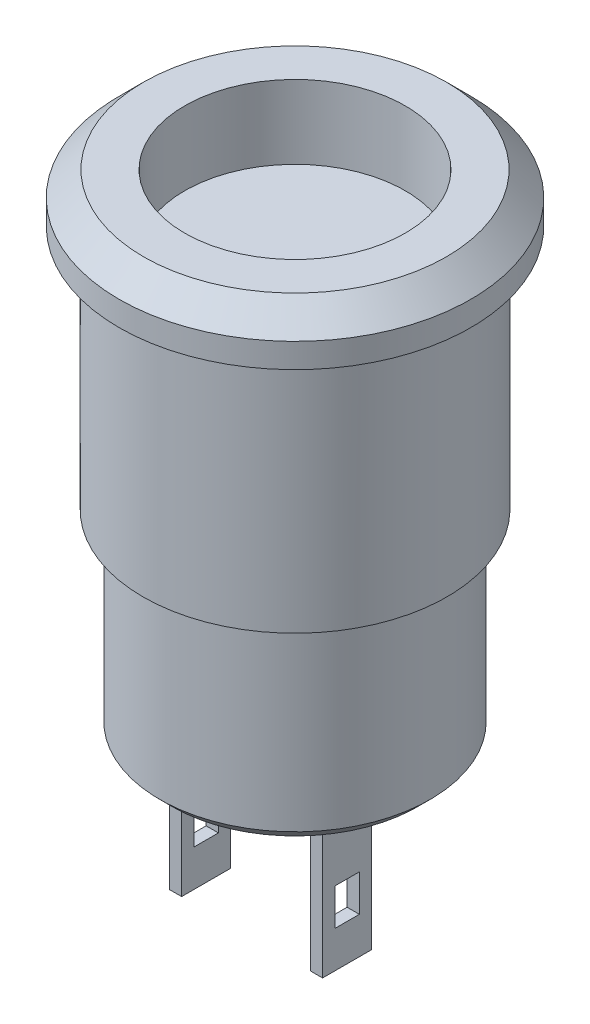
from build123d import *

# Parameters (mm, degrees)
SKETCH1_R           = 7.175
BOSS_EXTRUDE1_DEPTH = 2
SKETCH2_R           = 6.2
BOSS_EXTRUDE2_DEPTH = 10
SKETCH3_R           = 5.515
BOSS_EXTRUDE3_DEPTH = 8
CHAMFER2_SIZE       = 1
CHAMFER3_SIZE       = 0.5
SKETCH4_W           = 0.5
SKETCH4_H           = 2
BOSS_EXTRUDE4_DEPTH = 6
SKETCH5_W           = 1
SKETCH5_H           = 1.5
CUT_EXTRUDE1_DEPTH  = 28.084508949
BOSS_EXTRUDE6_DEPTH = 0.1
SKETCH6_R           = 4.5
CUT_EXTRUDE2_DEPTH  = 3


with BuildPart() as part:
    # Sketch1 → Boss-Extrude1 (new body)
    with BuildSketch(Plane(origin=(0, 0, 0), x_dir=(1, 0, 0), z_dir=(0, 1, 0))):
        with Locations(Location((0, 0, 0), (0, 0, 270))):
            Circle(SKETCH1_R)
    extrude(amount=BOSS_EXTRUDE1_DEPTH)

    # Sketch2 → Boss-Extrude2 (add)
    with BuildSketch(Plane.XZ):
        with Locations(Location((0, 0, 0), (0, 0, 90))):
            Circle(SKETCH2_R)
    extrude(amount=BOSS_EXTRUDE2_DEPTH)

    # Sketch3 → Boss-Extrude3 (add)
    with BuildSketch(Plane.XZ.offset(10)):
        with Locations(Location((0, 0, 0), (0, 0, 270))):
            Circle(SKETCH3_R)
    extrude(amount=BOSS_EXTRUDE3_DEPTH)

    # Chamfer2
    chamfer2_edges = [part.edges().sort_by_distance(p)[0] for p in [
        (0, 2, -7.175),
    ]]
    chamfer(chamfer2_edges, length=CHAMFER2_SIZE)

    # Chamfer3
    chamfer3_edges = [part.edges().sort_by_distance(p)[0] for p in [
        (0, -18, 5.515),
    ]]
    chamfer(chamfer3_edges, length=CHAMFER3_SIZE)

    # Sketch4 → Boss-Extrude4 (add)
    with BuildSketch(Plane.XZ.offset(18)):
        with Locations((2.875, 1)):
            Rectangle(SKETCH4_W, SKETCH4_H)
        with Locations((-2.875, 1)):
            Rectangle(SKETCH4_W, SKETCH4_H)
    extrude(amount=BOSS_EXTRUDE4_DEPTH)

    # Sketch5 → Cut-Extrude1 (cut, through all)
    with BuildSketch(Plane.ZY.offset(3.125)):
        with Locations((1, -21.75)):
            Rectangle(SKETCH5_W, SKETCH5_H)
    extrude(amount=-CUT_EXTRUDE1_DEPTH, mode=Mode.SUBTRACT)

    # Sketch7 → Boss-Extrude6 (add)
    # profile 1 of 18: a face of its own
    with BuildSketch(Plane(origin=(0, -18, 0), x_dir=(-1, 0, 0), z_dir=(0, -1, 0))):
        with BuildLine():
            Line((-2.393810309, 3.233762313), (-2.456630821, 3.233762313))
            add(Edge.make_bspline(
                [(-2.456630821, 3.233762313), (-2.454928911, 3.24080881), (-2.451601816, 3.254584135), (-2.444662301, 3.274265587), (-2.43710245, 3.292890291), (-2.428024629, 3.310109506), (-2.418122879, 3.326269286), (-2.406778334, 3.341003111), (-2.39451439, 3.354685704), (-2.3809494, 3.366828352), (-2.366723668, 3.377823898), (-2.351636744, 3.387198909), (-2.335992165, 3.39526374), (-2.319681538, 3.401907786), (-2.302656304, 3.406912891), (-2.285070379, 3.410544252), (-2.266877679, 3.412902475), (-2.254528161, 3.413132628), (-2.248257424, 3.413249493)],
                knots=[0, 0, 0, 0, 1.162005537, 2.271625781, 3.343758855, 4.383309926, 5.390229558, 6.379919256, 7.361854164, 8.333198761, 9.295911338, 10.242430842, 11.177959212, 12.116337295, 13.062827104, 14.020064771, 14.994644689, 16, 16, 16, 16], degree=3))
            add(Edge.make_bspline(
                [(-2.248257424, 3.413249493), (-2.239120875, 3.412973647), (-2.221047073, 3.412427971), (-2.194494464, 3.407445084), (-2.1688891, 3.399560058), (-2.144511251, 3.388665312), (-2.121867564, 3.37522785), (-2.101720327, 3.359234902), (-2.084342624, 3.340995042), (-2.069763749, 3.320848529), (-2.058348749, 3.299317427), (-2.049931474, 3.277157396), (-2.044807138, 3.254421001), (-2.044143027, 3.239069546), (-2.043810309, 3.231378499)],
                knots=[0, 0, 0, 0, 1.083050992, 2.142477498, 3.193116406, 4.255571735, 5.30263384, 6.308962982, 7.297363603, 8.282367274, 9.249857812, 10.179914175, 11.08814088, 12, 12, 12, 12], degree=3))
            add(Edge.make_bspline(
                [(-2.043810309, 3.231378499), (-2.044043027, 3.22397714), (-2.04449842, 3.209493829), (-2.048365161, 3.18834953), (-2.054872414, 3.16842121), (-2.063886366, 3.149624977), (-2.075554676, 3.132080009), (-2.089689216, 3.115746831), (-2.106389748, 3.100552999), (-2.119045536, 3.091849105), (-2.12556111, 3.087368082)],
                knots=[0, 0, 0, 0, 1.024540389, 2.004866551, 2.965041327, 3.920577974, 4.882998113, 5.874504559, 6.905732034, 8, 8, 8, 8], degree=3))
            add(Edge.make_bspline(
                [(-2.12556111, 3.087368082), (-2.118114759, 3.083772448), (-2.103361384, 3.076648456), (-2.083251278, 3.062677305), (-2.064995703, 3.046546036), (-2.054814959, 3.033957505), (-2.049699732, 3.027632505)],
                knots=[0, 0, 0, 0, 1.015518401, 2.012035669, 3.001164323, 4, 4, 4, 4], degree=3))
            add(Edge.make_bspline(
                [(-2.049699732, 3.027632505), (-2.046331463, 3.023020955), (-2.039650084, 3.013873372), (-2.031402977, 2.999166087), (-2.023921154, 2.984295789), (-2.01809111, 2.968863908), (-2.013576337, 2.953049305), (-2.010349131, 2.936824826), (-2.008344302, 2.920177221), (-2.008057192, 2.908914725), (-2.007912873, 2.903253499)],
                knots=[0, 0, 0, 0, 1.025084078, 2.033381695, 3.024893161, 4.013698104, 4.991890475, 5.976764909, 6.982997093, 8, 8, 8, 8], degree=3))
            add(Edge.make_bspline(
                [(-2.007912873, 2.903253499), (-2.008271775, 2.893451555), (-2.008987892, 2.873893794), (-2.015388707, 2.84499885), (-2.025311355, 2.81675375), (-2.039402742, 2.789738782), (-2.056576244, 2.764462706), (-2.077007709, 2.741847444), (-2.10046499, 2.722407723), (-2.12662612, 2.706165677), (-2.154969546, 2.693182093), (-2.185284664, 2.684170604), (-2.217134675, 2.678301404), (-2.238976134, 2.677672031), (-2.250080341, 2.677352057)],
                knots=[0, 0, 0, 0, 0.955779014, 1.907060117, 2.875433937, 3.871313158, 4.872415639, 5.851225146, 6.836215519, 7.83643374, 8.849228613, 9.86973379, 10.916971861, 12, 12, 12, 12], degree=3))
            add(Edge.make_bspline(
                [(-2.250080341, 2.677352057), (-2.257564201, 2.677525699), (-2.272289942, 2.67786737), (-2.293938641, 2.68020309), (-2.314602981, 2.684469091), (-2.334310901, 2.690209753), (-2.353079908, 2.697488101), (-2.370852729, 2.706551841), (-2.387738708, 2.717214141), (-2.403578498, 2.729600859), (-2.418370212, 2.743457126), (-2.431720756, 2.759028928), (-2.443852715, 2.776028409), (-2.454441243, 2.79465302), (-2.463968633, 2.814662072), (-2.471804825, 2.836311772), (-2.478701938, 2.859408576), (-2.481908631, 2.875504124), (-2.483553898, 2.883762313)],
                knots=[0, 0, 0, 0, 1.048658725, 2.063410685, 3.046034179, 4.001477787, 4.936774919, 5.862367409, 6.792675028, 7.730719943, 8.675894397, 9.627829632, 10.600096036, 11.597688215, 12.626045268, 13.701542398, 14.82072376, 16, 16, 16, 16], degree=3))
            Line((-2.483553898, 2.883762313), (-2.420733385, 2.883762313))
            add(Edge.make_bspline(
                [(-2.420733385, 2.883762313), (-2.419096727, 2.87837251), (-2.415913285, 2.867888876), (-2.410494425, 2.852800815), (-2.404320771, 2.838969204), (-2.397697859, 2.82629258), (-2.39074217, 2.814646099), (-2.382959185, 2.804337726), (-2.374925356, 2.794914685), (-2.368869485, 2.789605763), (-2.365905661, 2.787007505)],
                knots=[0, 0, 0, 0, 1.198163088, 2.33053128, 3.407730985, 4.417276592, 5.372219308, 6.28897303, 7.162600585, 8, 8, 8, 8], degree=3))
            add(Edge.make_bspline(
                [(-2.365905661, 2.787007505), (-2.361986346, 2.783985839), (-2.354159813, 2.777951832), (-2.341406167, 2.770251507), (-2.32799319, 2.763579301), (-2.313630255, 2.758482562), (-2.298627301, 2.75416703), (-2.282741828, 2.751342926), (-2.266113984, 2.749405292), (-2.254760432, 2.749234306), (-2.248958546, 2.749146928)],
                knots=[0, 0, 0, 0, 0.946170439, 1.889420265, 2.845303464, 3.807233317, 4.801018734, 5.828864929, 6.890507805, 8, 8, 8, 8], degree=3))
            add(Edge.make_bspline(
                [(-2.248958546, 2.749146928), (-2.242407845, 2.74927011), (-2.229598516, 2.749510979), (-2.210907544, 2.751726121), (-2.193126054, 2.754952203), (-2.176451469, 2.7599348), (-2.160665368, 2.76609097), (-2.145989038, 2.773820651), (-2.132229817, 2.782889596), (-2.119563936, 2.793197427), (-2.108174834, 2.804481727), (-2.098146931, 2.816284341), (-2.089621999, 2.828555507), (-2.082745283, 2.841363131), (-2.077315173, 2.854654177), (-2.073618533, 2.868465942), (-2.07104823, 2.882685396), (-2.070838908, 2.892351189), (-2.070733385, 2.897223852)],
                knots=[0, 0, 0, 0, 1.217147791, 2.380027433, 3.494444702, 4.572153297, 5.609568379, 6.639424714, 7.649109417, 8.668170816, 9.669597737, 10.625200337, 11.543417969, 12.441394052, 13.322311151, 14.205496177, 15.095365482, 16, 16, 16, 16], degree=3))
            add(Edge.make_bspline(
                [(-2.070733385, 2.897223852), (-2.071039446, 2.903746119), (-2.071650043, 2.916758201), (-2.076311759, 2.935901716), (-2.083979532, 2.954346398), (-2.094714034, 2.971777556), (-2.10778118, 2.987932737), (-2.123054162, 3.002347033), (-2.140659807, 3.014241051), (-2.156863781, 3.022458783), (-2.171216812, 3.028066198), (-2.183499889, 3.031801191), (-2.19725121, 3.034963922), (-2.21230448, 3.037906376), (-2.228773123, 3.040410646), (-2.246639211, 3.042499009), (-2.265906363, 3.044170017), (-2.279244596, 3.044916236), (-2.286118001, 3.045300775)],
                knots=[0, 0, 0, 0, 1.07054697, 2.135767047, 3.216561865, 4.33974944, 5.486079747, 6.621378074, 7.775625952, 8.963672916, 9.598146892, 10.304877434, 11.070270905, 11.915000392, 12.823868403, 13.805723172, 14.86925407, 16, 16, 16, 16], degree=3))
            Line((-2.286118001, 3.045300775), (-2.286118001, 3.117095646))
            add(Edge.make_bspline(
                [(-2.286118001, 3.117095646), (-2.277457768, 3.117242607), (-2.260494498, 3.117530467), (-2.235715637, 3.121012069), (-2.212020975, 3.125828195), (-2.189935627, 3.133205233), (-2.169805884, 3.141773293), (-2.152341963, 3.151743735), (-2.137788534, 3.162826684), (-2.12621632, 3.175193206), (-2.117510474, 3.188456216), (-2.111145115, 3.202279547), (-2.107385049, 3.21678436), (-2.106883116, 3.226683293), (-2.106630821, 3.231658948)],
                knots=[0, 0, 0, 0, 1.321986639, 2.589447074, 3.816329219, 5.01088745, 6.139805852, 7.153945165, 8.075214402, 8.924034688, 9.728124013, 10.488707548, 11.240355623, 12, 12, 12, 12], degree=3))
            add(Edge.make_bspline(
                [(-2.106630821, 3.231658948), (-2.106713704, 3.235314497), (-2.106878594, 3.242587038), (-2.108958049, 3.253212052), (-2.112082857, 3.263512241), (-2.116378803, 3.273443803), (-2.122128843, 3.282937858), (-2.12901004, 3.292075348), (-2.13720366, 3.300804103), (-2.14659275, 3.308940167), (-2.156675111, 3.316694015), (-2.167725066, 3.323276742), (-2.179409441, 3.328905755), (-2.191741172, 3.333547655), (-2.204760278, 3.337039513), (-2.218405589, 3.339546681), (-2.232703126, 3.341114212), (-2.242457472, 3.341339895), (-2.247416078, 3.341454621)],
                knots=[0, 0, 0, 0, 0.884392785, 1.759457502, 2.611959086, 3.489218968, 4.37281399, 5.2945488, 6.255912374, 7.266815255, 8.301784654, 9.332968512, 10.37626691, 11.440494194, 12.520033166, 13.637162961, 14.798855837, 16, 16, 16, 16], degree=3))
            add(Edge.make_bspline(
                [(-2.247416078, 3.341454621), (-2.255386411, 3.341176348), (-2.270954327, 3.340632818), (-2.29339731, 3.335872215), (-2.314261177, 3.328276598), (-2.33020891, 3.319209994), (-2.341985425, 3.310259908), (-2.350400813, 3.30244343), (-2.358664915, 3.293756866), (-2.36623405, 3.283665191), (-2.373888845, 3.272851833), (-2.380857758, 3.260767096), (-2.387629696, 3.247726217), (-2.391710206, 3.23850709), (-2.393810309, 3.233762313)],
                knots=[0, 0, 0, 0, 1.472543308, 2.876219568, 4.221790263, 5.565193594, 6.249813518, 6.953379497, 7.687249741, 8.463570142, 9.283606569, 10.136032583, 11.040678096, 12, 12, 12, 12], degree=3))
        make_face()
    # profile 2 of 18: a face of its own
    with BuildSketch(Plane(origin=(0, -18, 0), x_dir=(-1, 0, 0), z_dir=(0, -1, 0))):
        Polygon((-1.59509236, 3.395300775), (-1.272015437, 2.695300775), (-1.3403047, 2.695300775), (-1.443790276, 2.919659749), (-1.761118001, 2.919659749), (-1.867548289, 2.695300775), (-1.936118001, 2.695300775), (-1.604066719, 3.395300775), align=None)
        Polygon((-1.600280661, 3.258862473), (-1.727043482, 2.991454621), (-1.476883225, 2.991454621), align=None, mode=Mode.SUBTRACT)
    # profile 3 of 18: a face of its own
    with BuildSketch(Plane(origin=(0, -18, 0), x_dir=(-1, 0, 0), z_dir=(0, -1, 0))):
        Polygon((-1.060416879, 3.395300775), (-0.930989796, 3.395300775), (-0.930989796, 2.695300775), (-0.993810309, 2.695300775), (-0.993810309, 3.323505903), (-1.101502616, 3.323505903), align=None)
    # profile 4 of 18: a face of its own
    with BuildSketch(Plane(origin=(0, -18, 0), x_dir=(-1, 0, 0), z_dir=(0, -1, 0))):
        with BuildLine():
            Line((-0.580989796, 3.179916159), (-0.643810309, 3.179916159))
            add(Edge.make_bspline(
                [(-0.643810309, 3.179916159), (-0.643400878, 3.188250337), (-0.642596767, 3.20461844), (-0.638831109, 3.228483221), (-0.633442934, 3.251294181), (-0.625824643, 3.272868164), (-0.616363387, 3.293395925), (-0.605017382, 3.312795928), (-0.591578612, 3.330994166), (-0.576337265, 3.347821935), (-0.559783537, 3.363259449), (-0.541922349, 3.376590497), (-0.523153344, 3.387854032), (-0.503533464, 3.39727028), (-0.482841351, 3.404338249), (-0.46126478, 3.409582577), (-0.438708953, 3.412737846), (-0.423340948, 3.413077003), (-0.415525052, 3.413249493)],
                knots=[0, 0, 0, 0, 1.10065271, 2.161652631, 3.183658789, 4.190468796, 5.17591951, 6.163126047, 7.15150782, 8.156236427, 9.156009102, 10.134482811, 11.092018607, 12.041330605, 13.001268258, 13.972401359, 14.968799086, 16, 16, 16, 16], degree=3))
            add(Edge.make_bspline(
                [(-0.415525052, 3.413249493), (-0.407849437, 3.413069801), (-0.392767128, 3.412716714), (-0.370754725, 3.409684508), (-0.349799267, 3.40493539), (-0.329941713, 3.398272307), (-0.3113405, 3.389315421), (-0.293855891, 3.378555914), (-0.277279729, 3.366111947), (-0.262358373, 3.351461185), (-0.248656757, 3.335820708), (-0.236836306, 3.319123127), (-0.226713673, 3.30187727), (-0.218276137, 3.28395163), (-0.212064909, 3.265177424), (-0.207349268, 3.245827983), (-0.204683785, 3.225703021), (-0.2042747, 3.21208171), (-0.204066719, 3.205156544)],
                knots=[0, 0, 0, 0, 1.111607364, 2.184268762, 3.212621178, 4.221274766, 5.211760367, 6.196651075, 7.1921475, 8.207485113, 9.220403448, 10.201281604, 11.166441695, 12.114753415, 13.065576456, 14.026450734, 14.996634279, 16, 16, 16, 16], degree=3))
            add(Edge.make_bspline(
                [(-0.204066719, 3.205156544), (-0.204405371, 3.195406977), (-0.205076734, 3.176078934), (-0.210819609, 3.147675962), (-0.219788911, 3.120157278), (-0.230588383, 3.098009817), (-0.241482871, 3.080163119), (-0.251300373, 3.065469378), (-0.262793335, 3.049648284), (-0.276129035, 3.032752817), (-0.291031609, 3.014650636), (-0.307636042, 2.995352676), (-0.326060738, 2.975058322), (-0.338992438, 2.961197202), (-0.345693321, 2.954014717)],
                knots=[0, 0, 0, 0, 1.184426356, 2.348067706, 3.509069118, 4.696110526, 5.333549288, 6.050745305, 6.844228056, 7.710549037, 8.667450064, 9.695053472, 10.805634456, 12, 12, 12, 12], degree=3))
            Line((-0.345693321, 2.954014717), (-0.520833546, 2.767095646))
            Line((-0.520833546, 2.767095646), (-0.19509236, 2.767095646))
            Line((-0.19509236, 2.767095646), (-0.19509236, 2.695300775))
            Line((-0.19509236, 2.695300775), (-0.670733385, 2.695300775))
            Line((-0.670733385, 2.695300775), (-0.399259026, 2.9850043))
            add(Edge.make_bspline(
                [(-0.399259026, 2.9850043), (-0.392649449, 2.991903962), (-0.379953804, 3.005156799), (-0.361997288, 3.024505391), (-0.345869491, 3.042455299), (-0.331466012, 3.058972609), (-0.319099311, 3.074298922), (-0.308124865, 3.087937863), (-0.299331746, 3.100488753), (-0.289788667, 3.115036876), (-0.280545871, 3.132799339), (-0.2726034, 3.154506077), (-0.26776043, 3.176851528), (-0.267179463, 3.191951935), (-0.266887232, 3.199547569)],
                knots=[0, 0, 0, 0, 1.329631726, 2.553950428, 3.673215718, 4.687767853, 5.603093632, 6.413772471, 7.123043292, 7.734684054, 8.834405432, 9.900288307, 10.943827018, 12, 12, 12, 12], degree=3))
            add(Edge.make_bspline(
                [(-0.266887232, 3.199547569), (-0.26701438, 3.204323849), (-0.267264965, 3.213736979), (-0.269476505, 3.227538131), (-0.272818606, 3.240851094), (-0.277607658, 3.253716818), (-0.283929006, 3.266005948), (-0.291623682, 3.277733444), (-0.300501694, 3.289071237), (-0.310771948, 3.299701897), (-0.322054252, 3.309438138), (-0.333973102, 3.318062955), (-0.346583123, 3.325270777), (-0.359831147, 3.331179477), (-0.373680241, 3.335814553), (-0.38815719, 3.339026269), (-0.403221993, 3.341042765), (-0.413508693, 3.3413156), (-0.418750212, 3.341454621)],
                knots=[0, 0, 0, 0, 0.991446411, 1.95395049, 2.89581595, 3.838931463, 4.798493298, 5.75982156, 6.748411868, 7.785213223, 8.824556874, 9.840280684, 10.836137867, 11.835679398, 12.848801643, 13.863922112, 14.911575587, 16, 16, 16, 16], degree=3))
            add(Edge.make_bspline(
                [(-0.418750212, 3.341454621), (-0.424224379, 3.341311614), (-0.434974738, 3.341030773), (-0.450758545, 3.33906624), (-0.4658157, 3.335677072), (-0.480184081, 3.331041738), (-0.493887998, 3.325150028), (-0.506860807, 3.317811679), (-0.519073385, 3.30905498), (-0.530548689, 3.299126869), (-0.541121485, 3.288073349), (-0.55041086, 3.275751356), (-0.558527663, 3.262385873), (-0.56560951, 3.248012963), (-0.571360648, 3.232502207), (-0.575755278, 3.215908666), (-0.579232647, 3.19830439), (-0.580394351, 3.186147373), (-0.580989796, 3.179916159)],
                knots=[0, 0, 0, 0, 1.031018746, 2.02475058, 2.990194455, 3.934040569, 4.864654155, 5.795059489, 6.735614925, 7.690564532, 8.649604399, 9.611025574, 10.590972636, 11.591080095, 12.624614302, 13.701020113, 14.821632451, 16, 16, 16, 16], degree=3))
        make_face()
    # profile 5 of 18: a face of its own
    with BuildSketch(Plane(origin=(0, -18, 0), x_dir=(-1, 0, 0), z_dir=(0, -1, 0))):
        with BuildLine():
            Line((0.307471743, 3.395300775), (0.307471743, 3.323505903))
            Line((0.307471743, 3.323505903), (0.069370781, 3.323505903))
            Line((0.069370781, 3.323505903), (0.031650429, 3.139391319))
            add(Edge.make_bspline(
                [(0.031650429, 3.139391319), (0.039061604, 3.141437374), (0.053419583, 3.145401281), (0.074611555, 3.149802435), (0.094729996, 3.152455523), (0.10778507, 3.152817786), (0.114102352, 3.152993082)],
                knots=[0, 0, 0, 0, 1.100273476, 2.13160584, 3.095893838, 4, 4, 4, 4], degree=3))
            add(Edge.make_bspline(
                [(0.114102352, 3.152993082), (0.1219191, 3.152823895), (0.137288779, 3.152491231), (0.159776569, 3.149296861), (0.181243147, 3.144268878), (0.201643621, 3.137244774), (0.221015731, 3.128262827), (0.239181244, 3.117042839), (0.256412826, 3.103936173), (0.272401345, 3.08886717), (0.286906207, 3.072282847), (0.299659405, 3.054451273), (0.310491923, 3.035545741), (0.319204074, 3.015385619), (0.326160941, 2.994193788), (0.330791339, 2.971747272), (0.333874681, 2.948257648), (0.334219159, 2.932196734), (0.33439482, 2.924006704)],
                knots=[0, 0, 0, 0, 1.052922333, 2.070308379, 3.05430497, 4.020497103, 4.973039431, 5.925935799, 6.892292201, 7.88610001, 8.88166317, 9.857072816, 10.836096531, 11.812156883, 12.81219415, 13.836441305, 14.89672472, 16, 16, 16, 16], degree=3))
            add(Edge.make_bspline(
                [(0.33439482, 2.924006704), (0.334261805, 2.91830226), (0.333997572, 2.906970463), (0.332653855, 2.890141622), (0.330066711, 2.873669056), (0.326593167, 2.857550577), (0.322084683, 2.841816703), (0.316626872, 2.826422397), (0.309947667, 2.811463476), (0.302621392, 2.796798397), (0.294372096, 2.782758696), (0.285216395, 2.769628898), (0.275543296, 2.757212042), (0.265135019, 2.745641295), (0.25389482, 2.734992692), (0.241958827, 2.725203036), (0.229422283, 2.716106769), (0.216091235, 2.70807313), (0.202262738, 2.700680539), (0.187737095, 2.694615832), (0.172844954, 2.689193726), (0.157371979, 2.684871821), (0.141353217, 2.68148531), (0.124762262, 2.67918519), (0.107686128, 2.677509902), (0.096111125, 2.677405031), (0.090264211, 2.677352057)],
                knots=[0, 0, 0, 0, 1.056347294, 2.098418968, 3.122841568, 4.141288669, 5.149314143, 6.15115421, 7.162517403, 8.180376062, 9.185164535, 10.17417709, 11.141909838, 12.097768115, 13.052685741, 14.0056014, 14.954263652, 15.917497458, 16.885230207, 17.854509472, 18.828990115, 19.81800267, 20.826176721, 21.857883937, 22.917946725, 24, 24, 24, 24], degree=3))
            add(Edge.make_bspline(
                [(0.090264211, 2.677352057), (0.083289375, 2.677490224), (0.069567208, 2.677762053), (0.049463095, 2.68060575), (0.030120174, 2.684678533), (0.011694154, 2.690805787), (-0.005980099, 2.698483246), (-0.022664643, 2.70818648), (-0.038785798, 2.719182301), (-0.053688205, 2.732158372), (-0.067519428, 2.746341508), (-0.07990073, 2.761733036), (-0.090927445, 2.778078925), (-0.100422994, 2.795458555), (-0.108522599, 2.813826262), (-0.114885596, 2.833250862), (-0.120021267, 2.853630863), (-0.122193951, 2.867661565), (-0.123297488, 2.874787954)],
                knots=[0, 0, 0, 0, 1.0467383, 2.05933395, 3.04377827, 4.011590433, 4.970194871, 5.932262533, 6.905835911, 7.896367577, 8.894135286, 9.877477877, 10.858688626, 11.851381753, 12.8477658, 13.868841284, 14.917554742, 16, 16, 16, 16], degree=3))
            Line((-0.123297488, 2.874787954), (-0.060476975, 2.874787954))
            add(Edge.make_bspline(
                [(-0.060476975, 2.874787954), (-0.058931264, 2.868112664), (-0.05596032, 2.855282385), (-0.049439171, 2.837256116), (-0.041465996, 2.821192272), (-0.031985126, 2.806878355), (-0.02067512, 2.794396556), (-0.007769234, 2.783273143), (0.006700311, 2.773238117), (0.022778957, 2.764873564), (0.039741572, 2.757739813), (0.057495014, 2.752989474), (0.075555884, 2.749649296), (0.087771558, 2.749314943), (0.093910044, 2.749146928)],
                knots=[0, 0, 0, 0, 1.136247022, 2.183929868, 3.172523383, 4.106158343, 5.02341133, 5.958108904, 6.928429099, 7.938127109, 8.96079061, 9.975095812, 10.982467395, 12, 12, 12, 12], degree=3))
            add(Edge.make_bspline(
                [(0.093910044, 2.749146928), (0.099901733, 2.749311084), (0.111699417, 2.749634308), (0.129061695, 2.75212211), (0.14582427, 2.755953624), (0.161821741, 2.761687595), (0.177334049, 2.768656539), (0.191968803, 2.777599554), (0.206149378, 2.787891558), (0.219435005, 2.799682884), (0.231602895, 2.812676823), (0.242354119, 2.826572302), (0.251309502, 2.841395671), (0.258856324, 2.856890301), (0.264586983, 2.873226013), (0.26867518, 2.890326248), (0.271075791, 2.908233244), (0.271406027, 2.920447106), (0.271574307, 2.926670967)],
                knots=[0, 0, 0, 0, 1.027316725, 2.022795036, 3.002884548, 3.971462791, 4.93288096, 5.914575861, 6.907176829, 7.935150275, 8.956128384, 9.956726525, 10.942570165, 11.921478529, 12.907843606, 13.90538589, 14.932640048, 16, 16, 16, 16], degree=3))
            add(Edge.make_bspline(
                [(0.271574307, 2.926670967), (0.271442611, 2.932286117), (0.271184835, 2.943276975), (0.269078721, 2.959356816), (0.265415326, 2.974571425), (0.26033055, 2.988994272), (0.253874649, 3.00263896), (0.245985386, 3.015519572), (0.236514707, 3.027466339), (0.225696329, 3.038484849), (0.213844721, 3.048653824), (0.200755972, 3.057322642), (0.186703987, 3.064615425), (0.171858067, 3.070909025), (0.155865087, 3.075429174), (0.139041761, 3.078822751), (0.121206419, 3.080785824), (0.109012282, 3.081058201), (0.102744179, 3.081198211)],
                knots=[0, 0, 0, 0, 1.045622112, 2.046656509, 3.013763289, 3.955457236, 4.890082067, 5.820317437, 6.762574623, 7.722996705, 8.69280354, 9.665887285, 10.63943826, 11.638615906, 12.663482002, 13.728887084, 14.832589034, 16, 16, 16, 16], degree=3))
            add(Edge.make_bspline(
                [(0.102744179, 3.081198211), (0.097318393, 3.081082092), (0.086115522, 3.080842338), (0.068930956, 3.079077038), (0.050872612, 3.076229179), (0.032009713, 3.07231193), (0.012285611, 3.067185715), (-0.008258069, 3.061042814), (-0.029664522, 3.053698415), (-0.044088067, 3.048151972), (-0.051502616, 3.045300775)],
                knots=[0, 0, 0, 0, 0.817624296, 1.688186739, 2.600797293, 3.572016777, 4.590301741, 5.671205678, 6.80286297, 8, 8, 8, 8], degree=3))
            Line((-0.051502616, 3.045300775), (0.020292256, 3.395300775))
            Line((0.020292256, 3.395300775), (0.307471743, 3.395300775))
        make_face()
    # profile 6 of 18: a face of its own
    with BuildSketch(Plane(origin=(0, -18, 0), x_dir=(-1, 0, 0), z_dir=(0, -1, 0))):
        Polygon((0.41516405, 3.395300775), (0.482471743, 3.395300775), (0.715805076, 2.843658146), (0.949138409, 3.395300775), (1.016446102, 3.395300775), (0.720292256, 2.695300775), (0.711317897, 2.695300775), align=None)
    # profile 7 of 18: a face of its own
    with BuildSketch(Plane(origin=(0, -18, 0), x_dir=(-1, 0, 0), z_dir=(0, -1, 0))):
        Polygon((1.429266615, 3.395300775), (1.752343538, 2.695300775), (1.684054275, 2.695300775), (1.580568698, 2.919659749), (1.263240974, 2.919659749), (1.156810685, 2.695300775), (1.088240974, 2.695300775), (1.420292256, 3.395300775), align=None)
        Polygon((1.424078313, 3.258862473), (1.297315493, 2.991454621), (1.547475749, 2.991454621), align=None, mode=Mode.SUBTRACT)
    # profile 8 of 18: a face of its own
    with BuildSketch(Plane(origin=(0, -18, 0), x_dir=(-1, 0, 0), z_dir=(0, -1, 0))):
        with BuildLine():
            Line((2.524138409, 3.266855262), (2.469170461, 3.224787954))
            add(Edge.make_bspline(
                [(2.469170461, 3.224787954), (2.465249283, 3.229461148), (2.457459794, 3.238744531), (2.444927953, 3.25178044), (2.431867625, 3.263993492), (2.4182838, 3.275441868), (2.403931976, 3.285725221), (2.389159817, 3.295379442), (2.373720208, 3.30403299), (2.352369861, 3.314525587), (2.324440291, 3.325474818), (2.289281323, 3.334655464), (2.252579104, 3.340499699), (2.227539584, 3.341132668), (2.214803474, 3.341454621)],
                knots=[0, 0, 0, 0, 0.757959112, 1.505699292, 2.245454638, 2.979532153, 3.711538275, 4.438200793, 5.171680507, 5.909471876, 7.393775596, 8.890124382, 10.418191784, 12, 12, 12, 12], degree=3))
            add(Edge.make_bspline(
                [(2.214803474, 3.341454621), (2.207786814, 3.341373828), (2.193818615, 3.341212993), (2.17308892, 3.339091168), (2.15274631, 3.336108926), (2.132804017, 3.331683861), (2.113287425, 3.326089338), (2.094068945, 3.319404255), (2.075426825, 3.311133287), (2.057103177, 3.301991635), (2.039547335, 3.291666146), (2.022936326, 3.280403476), (2.007330732, 3.268329656), (1.99271821, 3.255399435), (1.97908382, 3.241671043), (1.966526358, 3.226998175), (1.955089276, 3.21142774), (1.944545871, 3.195165058), (1.935103324, 3.1782575), (1.927197348, 3.160642486), (1.920196324, 3.142621665), (1.914656475, 3.123991433), (1.910271572, 3.10488288), (1.907246039, 3.085244722), (1.905148345, 3.065117986), (1.904988309, 3.051476124), (1.90490764, 3.044599653)],
                knots=[0, 0, 0, 0, 1.054917814, 2.100044995, 3.131103042, 4.146048494, 5.169673617, 6.183595914, 7.203665975, 8.234915748, 9.262203917, 10.264457458, 11.251630812, 12.227803204, 13.197192746, 14.159520551, 15.12972552, 16.100847026, 17.073214652, 18.039054194, 19.002613845, 19.979014051, 20.95965708, 21.949030935, 22.966165397, 24, 24, 24, 24], degree=3))
            add(Edge.make_bspline(
                [(1.90490764, 3.044599653), (1.905160004, 3.034253389), (1.905655487, 3.013939872), (1.910065154, 2.98418575), (1.916766172, 2.955681615), (1.926809287, 2.928605647), (1.939193097, 2.902623975), (1.95484122, 2.878176204), (1.972964527, 2.854892891), (1.993819411, 2.833324302), (2.016700574, 2.813621557), (2.041250157, 2.79627144), (2.067407014, 2.781808464), (2.09488234, 2.769773275), (2.123887563, 2.760521929), (2.154370523, 2.754009104), (2.186264923, 2.749760668), (2.208058803, 2.749353931), (2.219150429, 2.749146928)],
                knots=[0, 0, 0, 0, 1.029171465, 2.020641659, 2.987623507, 3.938342917, 4.889210282, 5.84687017, 6.821220943, 7.821438502, 8.827599549, 9.822697543, 10.807740252, 11.797342354, 12.80366471, 13.83203677, 14.896651826, 16, 16, 16, 16], degree=3))
            add(Edge.make_bspline(
                [(2.219150429, 2.749146928), (2.231370966, 2.749484684), (2.255423908, 2.750149469), (2.290697514, 2.755781319), (2.324464667, 2.764912902), (2.356727184, 2.777692487), (2.387394113, 2.794305544), (2.416513445, 2.81444512), (2.444109759, 2.838302786), (2.460704016, 2.856519412), (2.469170461, 2.865813595)],
                knots=[0, 0, 0, 0, 1.028121516, 2.023589091, 2.998037872, 3.967518031, 4.937445131, 5.927275754, 6.942489185, 8, 8, 8, 8], degree=3))
            Line((2.469170461, 2.865813595), (2.524138409, 2.824166961))
            add(Edge.make_bspline(
                [(2.524138409, 2.824166961), (2.519714787, 2.81845927), (2.510888732, 2.807071229), (2.496597129, 2.791016887), (2.48154167, 2.77591608), (2.465610528, 2.761890556), (2.448986969, 2.748659662), (2.431372507, 2.736599296), (2.4129987, 2.725541119), (2.393927804, 2.715415734), (2.374180082, 2.706432285), (2.353779195, 2.698741531), (2.33281308, 2.692116554), (2.311280778, 2.686666166), (2.289137627, 2.682411949), (2.266463532, 2.679568015), (2.243209557, 2.677619632), (2.227521273, 2.677442048), (2.219571102, 2.677352057)],
                knots=[0, 0, 0, 0, 0.986787822, 1.968848986, 2.935600012, 3.899624008, 4.868462664, 5.837806735, 6.815139263, 7.798259679, 8.787526145, 9.778297419, 10.776456485, 11.791383307, 12.812564526, 13.85620153, 14.913611965, 16, 16, 16, 16], degree=3))
            add(Edge.make_bspline(
                [(2.219571102, 2.677352057), (2.212042368, 2.677404455), (2.19715523, 2.677508067), (2.17517548, 2.6791865), (2.153777564, 2.681476448), (2.133022639, 2.684924474), (2.112797444, 2.688993342), (2.093285327, 2.694447593), (2.074294285, 2.700557426), (2.055900617, 2.707738424), (2.038088677, 2.71584166), (2.020915914, 2.724999972), (2.004390228, 2.735136345), (1.988349144, 2.746027347), (1.973029627, 2.758022808), (1.958298922, 2.770956134), (1.944074427, 2.784783737), (1.93527389, 2.794754707), (1.930849147, 2.799767922)],
                knots=[0, 0, 0, 0, 1.114604814, 2.203992996, 3.262667896, 4.300477797, 5.318619304, 6.316056647, 7.298880507, 8.271930387, 9.238335007, 10.195173496, 11.151986948, 12.108099108, 13.064862484, 14.031167946, 15.010108607, 16, 16, 16, 16], degree=3))
            add(Edge.make_bspline(
                [(1.930849147, 2.799767922), (1.923762018, 2.80847616), (1.909673323, 2.825787502), (1.891648186, 2.853844698), (1.876218675, 2.88313834), (1.863743491, 2.913822326), (1.853990944, 2.945827803), (1.847234705, 2.979170906), (1.842844384, 3.013820494), (1.842342326, 3.037387852), (1.842087127, 3.049367281)],
                knots=[0, 0, 0, 0, 0.994628077, 1.977248131, 2.950237994, 3.925870899, 4.908910175, 5.911660606, 6.938484602, 8, 8, 8, 8], degree=3))
            add(Edge.make_bspline(
                [(1.842087127, 3.049367281), (1.842398166, 3.061958372), (1.843010115, 3.086730557), (1.848209274, 3.123085347), (1.856573034, 3.157915627), (1.868452411, 3.191156376), (1.883513482, 3.222982432), (1.902118804, 3.253150673), (1.924052233, 3.281854033), (1.949141746, 3.308656983), (1.976655213, 3.333164854), (2.006118976, 3.354726094), (2.037475366, 3.372669598), (2.070378936, 3.38766883), (2.105076072, 3.399197723), (2.141492746, 3.40726836), (2.179560529, 3.412291783), (2.205533014, 3.412926825), (2.218729756, 3.413249493)],
                knots=[0, 0, 0, 0, 1.032925535, 2.032216505, 3.007276963, 3.968222605, 4.92396291, 5.891752235, 6.871517503, 7.883894988, 8.900124299, 9.891468569, 10.874487609, 11.85992873, 12.854644235, 13.869047385, 14.917252991, 16, 16, 16, 16], degree=3))
            add(Edge.make_bspline(
                [(2.218729756, 3.413249493), (2.22677265, 3.413153065), (2.242692749, 3.412962196), (2.26624328, 3.411100968), (2.289171745, 3.407998246), (2.311493942, 3.403775033), (2.333318465, 3.398533568), (2.354478513, 3.391705509), (2.375098251, 3.383898202), (2.395047632, 3.374906509), (2.414230942, 3.364813161), (2.432642206, 3.353730036), (2.450135178, 3.341670875), (2.466832947, 3.32873824), (2.48245619, 3.314658528), (2.497448485, 3.299819009), (2.511300701, 3.283792244), (2.51985134, 3.272511257), (2.524138409, 3.266855262)],
                knots=[0, 0, 0, 0, 1.096760587, 2.17092713, 3.219439832, 4.250915756, 5.268269357, 6.278326846, 7.281116186, 8.274029601, 9.260640565, 10.235837813, 11.203064059, 12.156899882, 13.114053108, 14.069676657, 15.032185724, 16, 16, 16, 16], degree=3))
        make_face()
    # profile 9 of 18: a face of its own
    with BuildSketch(Plane(origin=(0, -18, 0), x_dir=(-1, 0, 0), z_dir=(0, -1, 0))):
        Polygon((-2.873237392, 2.028634108), (-2.743810309, 2.028634108), (-2.743810309, 1.328634108), (-2.806630821, 1.328634108), (-2.806630821, 1.956839236), (-2.914323129, 1.956839236), align=None)
    # profile 10 of 18: a face of its own
    with BuildSketch(Plane(origin=(0, -18, 0), x_dir=(-1, 0, 0), z_dir=(0, -1, 0))):
        with BuildLine():
            add(Edge.make_bspline(
                [(-2.371374411, 1.436326416), (-2.367476369, 1.436094782), (-2.359834712, 1.435640692), (-2.348786886, 1.432525357), (-2.338787955, 1.426993625), (-2.329881506, 1.41962107), (-2.32254021, 1.410681937), (-2.31681134, 1.400762755), (-2.313723143, 1.389622437), (-2.31327236, 1.381936502), (-2.313041078, 1.377993082)],
                knots=[0, 0, 0, 0, 1.020151414, 1.999887582, 2.974338812, 3.990962822, 5.007586832, 5.987933904, 6.967670073, 8, 8, 8, 8], degree=3))
            add(Edge.make_bspline(
                [(-2.313041078, 1.377993082), (-2.313280198, 1.374144416), (-2.313751739, 1.366554904), (-2.316804261, 1.355498611), (-2.322583871, 1.34557323), (-2.32983087, 1.336512803), (-2.338790156, 1.329124628), (-2.348810526, 1.32363996), (-2.359808777, 1.320301564), (-2.367472042, 1.319876304), (-2.371374411, 1.319659749)],
                knots=[0, 0, 0, 0, 1.009421747, 1.99056486, 2.972319754, 3.999869655, 5.017953583, 5.993804169, 6.978383603, 8, 8, 8, 8], degree=3))
            add(Edge.make_bspline(
                [(-2.371374411, 1.319659749), (-2.375279592, 1.319868468), (-2.382903529, 1.320275943), (-2.393860728, 1.323708505), (-2.403942121, 1.329073197), (-2.412899664, 1.336526579), (-2.420207358, 1.345526607), (-2.425732435, 1.355566967), (-2.429050464, 1.366523254), (-2.429486839, 1.374138183), (-2.429707744, 1.377993082)],
                knots=[0, 0, 0, 0, 1.022052826, 1.995314843, 2.982371812, 4.00089066, 5.028879526, 6.005146991, 6.990147033, 8, 8, 8, 8], degree=3))
            add(Edge.make_bspline(
                [(-2.429707744, 1.377993082), (-2.429495325, 1.381942958), (-2.429080601, 1.389654606), (-2.425725469, 1.400694428), (-2.420250226, 1.410728116), (-2.412849147, 1.419607432), (-2.403944288, 1.427044892), (-2.393885047, 1.432457851), (-2.382877139, 1.435665933), (-2.375275151, 1.436102437), (-2.371374411, 1.436326416)],
                knots=[0, 0, 0, 0, 1.032775665, 2.016367738, 2.991239715, 4.008302682, 5.025365648, 6.011011707, 6.979408107, 8, 8, 8, 8], degree=3))
        make_face()
    # profile 11 of 18: a face of its own
    with BuildSketch(Plane(origin=(0, -18, 0), x_dir=(-1, 0, 0), z_dir=(0, -1, 0))):
        with BuildLine():
            Line((-1.783553898, 2.028634108), (-1.783553898, 1.956839236))
            Line((-1.783553898, 1.956839236), (-2.02165486, 1.956839236))
            Line((-2.02165486, 1.956839236), (-2.059375212, 1.772724653))
            add(Edge.make_bspline(
                [(-2.059375212, 1.772724653), (-2.051964037, 1.774770707), (-2.037606058, 1.778734614), (-2.016414086, 1.783135768), (-1.996295645, 1.785788857), (-1.983240571, 1.786151119), (-1.976923289, 1.786326416)],
                knots=[0, 0, 0, 0, 1.100273476, 2.13160584, 3.095893838, 4, 4, 4, 4], degree=3))
            add(Edge.make_bspline(
                [(-1.976923289, 1.786326416), (-1.969106541, 1.786157229), (-1.953736862, 1.785824564), (-1.931249072, 1.782630194), (-1.909782494, 1.777602212), (-1.88938202, 1.770578107), (-1.87000991, 1.761596161), (-1.851844397, 1.750376172), (-1.834612815, 1.737269506), (-1.818624296, 1.722200504), (-1.804119434, 1.70561618), (-1.791366236, 1.687784606), (-1.780533718, 1.668879074), (-1.771821567, 1.648718952), (-1.764864701, 1.627527121), (-1.760234302, 1.605080605), (-1.75715096, 1.581590981), (-1.756806482, 1.565530067), (-1.756630821, 1.557340037)],
                knots=[0, 0, 0, 0, 1.052922333, 2.070308379, 3.05430497, 4.020497103, 4.973039431, 5.925935799, 6.892292201, 7.88610001, 8.88166317, 9.857072816, 10.836096531, 11.812156883, 12.81219415, 13.836441305, 14.89672472, 16, 16, 16, 16], degree=3))
            add(Edge.make_bspline(
                [(-1.756630821, 1.557340037), (-1.756763836, 1.551635593), (-1.757028069, 1.540303796), (-1.758371786, 1.523474956), (-1.76095893, 1.507002389), (-1.764432474, 1.490883911), (-1.768940958, 1.475150036), (-1.774398769, 1.459755731), (-1.781077974, 1.444796809), (-1.788404249, 1.43013173), (-1.796653545, 1.416092029), (-1.805809246, 1.402962232), (-1.815482345, 1.390545375), (-1.825890622, 1.378974629), (-1.837130821, 1.368326025), (-1.849066814, 1.358536369), (-1.861603358, 1.349440103), (-1.874934406, 1.341406464), (-1.888762903, 1.334013873), (-1.903288546, 1.327949165), (-1.918180687, 1.322527059), (-1.933653662, 1.318205154), (-1.949672424, 1.314818643), (-1.966263379, 1.312518523), (-1.983339513, 1.310843235), (-1.994914516, 1.310738364), (-2.00076143, 1.31068539)],
                knots=[0, 0, 0, 0, 1.056347294, 2.098418968, 3.122841568, 4.141288669, 5.149314143, 6.15115421, 7.162517403, 8.180376062, 9.185164535, 10.17417709, 11.141909838, 12.097768115, 13.052685741, 14.0056014, 14.954263652, 15.917497458, 16.885230207, 17.854509472, 18.828990115, 19.81800267, 20.826176721, 21.857883937, 22.917946725, 24, 24, 24, 24], degree=3))
            add(Edge.make_bspline(
                [(-2.00076143, 1.31068539), (-2.007736266, 1.310823558), (-2.021458433, 1.311095386), (-2.041562546, 1.313939083), (-2.060905467, 1.318011866), (-2.079331487, 1.32413912), (-2.09700574, 1.331816579), (-2.113690284, 1.341519814), (-2.129811439, 1.352515634), (-2.144713846, 1.365491705), (-2.158545069, 1.379674841), (-2.170926371, 1.39506637), (-2.181953086, 1.411412258), (-2.191448635, 1.428791889), (-2.19954824, 1.447159595), (-2.205911237, 1.466584195), (-2.211046908, 1.486964196), (-2.213219592, 1.500994898), (-2.214323129, 1.508121287)],
                knots=[0, 0, 0, 0, 1.0467383, 2.05933395, 3.04377827, 4.011590433, 4.970194871, 5.932262533, 6.905835911, 7.896367577, 8.894135286, 9.877477877, 10.858688626, 11.851381753, 12.8477658, 13.868841284, 14.917554742, 16, 16, 16, 16], degree=3))
            Line((-2.214323129, 1.508121287), (-2.151502616, 1.508121287))
            add(Edge.make_bspline(
                [(-2.151502616, 1.508121287), (-2.149956905, 1.501445997), (-2.146985961, 1.488615718), (-2.140464812, 1.47058945), (-2.132491637, 1.454525605), (-2.123010767, 1.440211688), (-2.111700761, 1.427729889), (-2.098794875, 1.416606476), (-2.08432533, 1.406571451), (-2.068246684, 1.398206897), (-2.051284069, 1.391073146), (-2.033530627, 1.386322808), (-2.015469757, 1.382982629), (-2.003254083, 1.382648277), (-1.997115597, 1.382480262)],
                knots=[0, 0, 0, 0, 1.136247022, 2.183929868, 3.172523383, 4.106158343, 5.02341133, 5.958108904, 6.928429099, 7.938127109, 8.96079061, 9.975095812, 10.982467395, 12, 12, 12, 12], degree=3))
            add(Edge.make_bspline(
                [(-1.997115597, 1.382480262), (-1.991123908, 1.382644417), (-1.979326224, 1.382967641), (-1.961963946, 1.385455443), (-1.945201371, 1.389286958), (-1.9292039, 1.395020929), (-1.913691592, 1.401989872), (-1.899056838, 1.410932888), (-1.884876263, 1.421224891), (-1.871590636, 1.433016217), (-1.859422746, 1.446010156), (-1.848671522, 1.459905635), (-1.839716139, 1.474729004), (-1.832169317, 1.490223635), (-1.826438658, 1.506559346), (-1.822350461, 1.523659581), (-1.81994985, 1.541566577), (-1.819619614, 1.553780439), (-1.819451334, 1.5600043)],
                knots=[0, 0, 0, 0, 1.027316725, 2.022795036, 3.002884548, 3.971462791, 4.93288096, 5.914575861, 6.907176829, 7.935150275, 8.956128384, 9.956726525, 10.942570165, 11.921478529, 12.907843606, 13.90538589, 14.932640048, 16, 16, 16, 16], degree=3))
            add(Edge.make_bspline(
                [(-1.819451334, 1.5600043), (-1.81958303, 1.565619451), (-1.819840806, 1.576610308), (-1.82194692, 1.59269015), (-1.825610315, 1.607904758), (-1.830695091, 1.622327605), (-1.837150992, 1.635972293), (-1.845040255, 1.648852905), (-1.854510934, 1.660799672), (-1.865329312, 1.671818183), (-1.87718092, 1.681987158), (-1.890269669, 1.690655975), (-1.904321654, 1.697948759), (-1.919167574, 1.704242358), (-1.935160554, 1.708762507), (-1.95198388, 1.712156084), (-1.969819222, 1.714119157), (-1.982013359, 1.714391535), (-1.988281462, 1.714531544)],
                knots=[0, 0, 0, 0, 1.045622112, 2.046656509, 3.013763289, 3.955457236, 4.890082067, 5.820317437, 6.762574623, 7.722996705, 8.69280354, 9.665887285, 10.63943826, 11.638615906, 12.663482002, 13.728887084, 14.832589034, 16, 16, 16, 16], degree=3))
            add(Edge.make_bspline(
                [(-1.988281462, 1.714531544), (-1.993707248, 1.714415426), (-2.004910119, 1.714175671), (-2.022094685, 1.712410372), (-2.040153029, 1.709562513), (-2.059015928, 1.705645263), (-2.07874003, 1.700519048), (-2.09928371, 1.694376148), (-2.120690163, 1.687031748), (-2.135113708, 1.681485305), (-2.142528257, 1.678634108)],
                knots=[0, 0, 0, 0, 0.817624296, 1.688186739, 2.600797293, 3.572016777, 4.590301741, 5.671205678, 6.80286297, 8, 8, 8, 8], degree=3))
            Line((-2.142528257, 1.678634108), (-2.070733385, 2.028634108))
            Line((-2.070733385, 2.028634108), (-1.783553898, 2.028634108))
        make_face()
    # profile 12 of 18: a face of its own
    with BuildSketch(Plane(origin=(0, -18, 0), x_dir=(-1, 0, 0), z_dir=(0, -1, 0))):
        Polygon((-1.33483595, 2.028634108), (-1.011759026, 1.328634108), (-1.080048289, 1.328634108), (-1.183533866, 1.552993082), (-1.500861591, 1.552993082), (-1.607291879, 1.328634108), (-1.675861591, 1.328634108), (-1.343810309, 2.028634108), align=None)
        Polygon((-1.340024251, 1.892195807), (-1.466787071, 1.624787954), (-1.216626815, 1.624787954), align=None, mode=Mode.SUBTRACT)
    # profile 13 of 18: a face of its own
    with BuildSketch(Plane(origin=(0, -18, 0), x_dir=(-1, 0, 0), z_dir=(0, -1, 0))):
        with BuildLine():
            Line((-0.859194924, 1.813249493), (-0.922015437, 1.813249493))
            add(Edge.make_bspline(
                [(-0.922015437, 1.813249493), (-0.921606006, 1.82158367), (-0.920801895, 1.837951773), (-0.917036237, 1.861816554), (-0.911648062, 1.884627514), (-0.904029771, 1.906201497), (-0.894568516, 1.926729258), (-0.88322251, 1.946129261), (-0.86978374, 1.964327499), (-0.854542393, 1.981155268), (-0.837988665, 1.996592782), (-0.820127478, 2.009923831), (-0.801358472, 2.021187365), (-0.781738592, 2.030603613), (-0.76104648, 2.037671582), (-0.739469908, 2.04291591), (-0.716914081, 2.046071179), (-0.701546076, 2.046410337), (-0.69373018, 2.046582826)],
                knots=[0, 0, 0, 0, 1.10065271, 2.161652631, 3.183658789, 4.190468796, 5.17591951, 6.163126047, 7.15150782, 8.156236427, 9.156009102, 10.134482811, 11.092018607, 12.041330605, 13.001268258, 13.972401359, 14.968799086, 16, 16, 16, 16], degree=3))
            add(Edge.make_bspline(
                [(-0.69373018, 2.046582826), (-0.686054565, 2.046403135), (-0.670972257, 2.046050048), (-0.648959854, 2.043017842), (-0.628004395, 2.038268723), (-0.608146841, 2.03160564), (-0.589545629, 2.022648755), (-0.57206102, 2.011889247), (-0.555484857, 1.999445281), (-0.540563501, 1.984794518), (-0.526861885, 1.969154041), (-0.515041434, 1.95245646), (-0.504918801, 1.935210603), (-0.496481265, 1.917284963), (-0.490270037, 1.898510757), (-0.485554396, 1.879161317), (-0.482888913, 1.859036355), (-0.482479828, 1.845415043), (-0.482271847, 1.838489877)],
                knots=[0, 0, 0, 0, 1.111607364, 2.184268762, 3.212621178, 4.221274766, 5.211760367, 6.196651075, 7.1921475, 8.207485113, 9.220403448, 10.201281604, 11.166441695, 12.114753415, 13.065576456, 14.026450734, 14.996634279, 16, 16, 16, 16], degree=3))
            add(Edge.make_bspline(
                [(-0.482271847, 1.838489877), (-0.4826105, 1.82874031), (-0.483281862, 1.809412268), (-0.489024737, 1.781009295), (-0.497994039, 1.753490611), (-0.508793511, 1.731343151), (-0.519688, 1.713496452), (-0.529505501, 1.698802711), (-0.540998463, 1.682981617), (-0.554334163, 1.66608615), (-0.569236737, 1.647983969), (-0.58584117, 1.62868601), (-0.604265866, 1.608391656), (-0.617197566, 1.594530536), (-0.62389845, 1.58734805)],
                knots=[0, 0, 0, 0, 1.184426356, 2.348067706, 3.509069118, 4.696110526, 5.333549288, 6.050745305, 6.844228056, 7.710549037, 8.667450064, 9.695053472, 10.805634456, 12, 12, 12, 12], degree=3))
            Line((-0.62389845, 1.58734805), (-0.799038674, 1.40042898))
            Line((-0.799038674, 1.40042898), (-0.473297488, 1.40042898))
            Line((-0.473297488, 1.40042898), (-0.473297488, 1.328634108))
            Line((-0.473297488, 1.328634108), (-0.948938514, 1.328634108))
            Line((-0.948938514, 1.328634108), (-0.677464155, 1.618337634))
            add(Edge.make_bspline(
                [(-0.677464155, 1.618337634), (-0.670854577, 1.625237295), (-0.658158932, 1.638490132), (-0.640202417, 1.657838724), (-0.624074619, 1.675788632), (-0.60967114, 1.692305942), (-0.597304439, 1.707632256), (-0.586329993, 1.721271196), (-0.577536875, 1.733822086), (-0.567993796, 1.748370209), (-0.558750999, 1.766132673), (-0.550808528, 1.787839411), (-0.545965558, 1.810184861), (-0.545384591, 1.825285268), (-0.54509236, 1.832880903)],
                knots=[0, 0, 0, 0, 1.329631726, 2.553950428, 3.673215718, 4.687767853, 5.603093632, 6.413772471, 7.123043292, 7.734684054, 8.834405432, 9.900288307, 10.943827018, 12, 12, 12, 12], degree=3))
            add(Edge.make_bspline(
                [(-0.54509236, 1.832880903), (-0.545219508, 1.837657183), (-0.545470093, 1.847070313), (-0.547681633, 1.860871464), (-0.551023734, 1.874184427), (-0.555812786, 1.887050151), (-0.562134134, 1.899339281), (-0.56982881, 1.911066777), (-0.578706822, 1.92240457), (-0.588977076, 1.93303523), (-0.60025938, 1.942771471), (-0.61217823, 1.951396288), (-0.624788251, 1.95860411), (-0.638036275, 1.96451281), (-0.651885369, 1.969147886), (-0.666362318, 1.972359602), (-0.681427122, 1.974376099), (-0.691713821, 1.974648933), (-0.696955341, 1.974787954)],
                knots=[0, 0, 0, 0, 0.991446411, 1.95395049, 2.89581595, 3.838931463, 4.798493298, 5.75982156, 6.748411868, 7.785213223, 8.824556874, 9.840280684, 10.836137867, 11.835679398, 12.848801643, 13.863922112, 14.911575587, 16, 16, 16, 16], degree=3))
            add(Edge.make_bspline(
                [(-0.696955341, 1.974787954), (-0.702429507, 1.974644948), (-0.713179866, 1.974364107), (-0.728963673, 1.972399574), (-0.744020828, 1.969010406), (-0.758389209, 1.964375071), (-0.772093126, 1.958483361), (-0.785065935, 1.951145012), (-0.797278513, 1.942388314), (-0.808753818, 1.932460202), (-0.819326613, 1.921406682), (-0.828615989, 1.909084689), (-0.836732791, 1.895719206), (-0.843814638, 1.881346296), (-0.849565776, 1.86583554), (-0.853960406, 1.849241999), (-0.857437775, 1.831637723), (-0.85859948, 1.819480706), (-0.859194924, 1.813249493)],
                knots=[0, 0, 0, 0, 1.031018746, 2.02475058, 2.990194455, 3.934040569, 4.864654155, 5.795059489, 6.735614925, 7.690564532, 8.649604399, 9.611025574, 10.590972636, 11.591080095, 12.624614302, 13.701020113, 14.821632451, 16, 16, 16, 16], degree=3))
        make_face()
    # profile 14 of 18: a face of its own
    with BuildSketch(Plane(origin=(0, -18, 0), x_dir=(-1, 0, 0), z_dir=(0, -1, 0))):
        with BuildLine():
            Line((0.029266615, 2.028634108), (0.029266615, 1.956839236))
            Line((0.029266615, 1.956839236), (-0.208834347, 1.956839236))
            Line((-0.208834347, 1.956839236), (-0.2465547, 1.772724653))
            add(Edge.make_bspline(
                [(-0.2465547, 1.772724653), (-0.239143525, 1.774770707), (-0.224785545, 1.778734614), (-0.203593573, 1.783135768), (-0.183475133, 1.785788857), (-0.170420059, 1.786151119), (-0.164102776, 1.786326416)],
                knots=[0, 0, 0, 0, 1.100273476, 2.13160584, 3.095893838, 4, 4, 4, 4], degree=3))
            add(Edge.make_bspline(
                [(-0.164102776, 1.786326416), (-0.156286029, 1.786157229), (-0.140916349, 1.785824564), (-0.11842856, 1.782630194), (-0.096961981, 1.777602212), (-0.076561507, 1.770578107), (-0.057189397, 1.761596161), (-0.039023885, 1.750376172), (-0.021792302, 1.737269506), (-0.005803783, 1.722200504), (0.008701078, 1.70561618), (0.021454276, 1.687784606), (0.032286794, 1.668879074), (0.040998945, 1.648718952), (0.047955812, 1.627527121), (0.052586211, 1.605080605), (0.055669553, 1.581590981), (0.05601403, 1.565530067), (0.056189691, 1.557340037)],
                knots=[0, 0, 0, 0, 1.052922333, 2.070308379, 3.05430497, 4.020497103, 4.973039431, 5.925935799, 6.892292201, 7.88610001, 8.88166317, 9.857072816, 10.836096531, 11.812156883, 12.81219415, 13.836441305, 14.89672472, 16, 16, 16, 16], degree=3))
            add(Edge.make_bspline(
                [(0.056189691, 1.557340037), (0.056056676, 1.551635593), (0.055792444, 1.540303796), (0.054448726, 1.523474956), (0.051861583, 1.507002389), (0.048388038, 1.490883911), (0.043879555, 1.475150036), (0.038421744, 1.459755731), (0.031742538, 1.444796809), (0.024416263, 1.43013173), (0.016166968, 1.416092029), (0.007011266, 1.402962232), (-0.002661832, 1.390545375), (-0.013070109, 1.378974629), (-0.024310308, 1.368326025), (-0.036246301, 1.358536369), (-0.048782845, 1.349440103), (-0.062113894, 1.341406464), (-0.07594239, 1.334013873), (-0.090468034, 1.327949165), (-0.105360174, 1.322527059), (-0.120833149, 1.318205154), (-0.136851911, 1.314818643), (-0.153442867, 1.312518523), (-0.170519001, 1.310843235), (-0.182094003, 1.310738364), (-0.187940917, 1.31068539)],
                knots=[0, 0, 0, 0, 1.056347294, 2.098418968, 3.122841568, 4.141288669, 5.149314143, 6.15115421, 7.162517403, 8.180376062, 9.185164535, 10.17417709, 11.141909838, 12.097768115, 13.052685741, 14.0056014, 14.954263652, 15.917497458, 16.885230207, 17.854509472, 18.828990115, 19.81800267, 20.826176721, 21.857883937, 22.917946725, 24, 24, 24, 24], degree=3))
            add(Edge.make_bspline(
                [(-0.187940917, 1.31068539), (-0.194915754, 1.310823558), (-0.20863792, 1.311095386), (-0.228742033, 1.313939083), (-0.248084954, 1.318011866), (-0.266510975, 1.32413912), (-0.284185227, 1.331816579), (-0.300869771, 1.341519814), (-0.316990926, 1.352515634), (-0.331893333, 1.365491705), (-0.345724556, 1.379674841), (-0.358105858, 1.39506637), (-0.369132573, 1.411412258), (-0.378628123, 1.428791889), (-0.386727727, 1.447159595), (-0.393090725, 1.466584195), (-0.398226396, 1.486964196), (-0.40039908, 1.500994898), (-0.401502616, 1.508121287)],
                knots=[0, 0, 0, 0, 1.0467383, 2.05933395, 3.04377827, 4.011590433, 4.970194871, 5.932262533, 6.905835911, 7.896367577, 8.894135286, 9.877477877, 10.858688626, 11.851381753, 12.8477658, 13.868841284, 14.917554742, 16, 16, 16, 16], degree=3))
            Line((-0.401502616, 1.508121287), (-0.338682103, 1.508121287))
            add(Edge.make_bspline(
                [(-0.338682103, 1.508121287), (-0.337136392, 1.501445997), (-0.334165449, 1.488615718), (-0.327644299, 1.47058945), (-0.319671124, 1.454525605), (-0.310190254, 1.440211688), (-0.298880248, 1.427729889), (-0.285974362, 1.416606476), (-0.271504818, 1.406571451), (-0.255426172, 1.398206897), (-0.238463556, 1.391073146), (-0.220710114, 1.386322808), (-0.202649244, 1.382982629), (-0.19043357, 1.382648277), (-0.184295084, 1.382480262)],
                knots=[0, 0, 0, 0, 1.136247022, 2.183929868, 3.172523383, 4.106158343, 5.02341133, 5.958108904, 6.928429099, 7.938127109, 8.96079061, 9.975095812, 10.982467395, 12, 12, 12, 12], degree=3))
            add(Edge.make_bspline(
                [(-0.184295084, 1.382480262), (-0.178303395, 1.382644417), (-0.166505711, 1.382967641), (-0.149143433, 1.385455443), (-0.132380859, 1.389286958), (-0.116383387, 1.395020929), (-0.100871079, 1.401989872), (-0.086236325, 1.410932888), (-0.07205575, 1.421224891), (-0.058770123, 1.433016217), (-0.046602233, 1.446010156), (-0.035851009, 1.459905635), (-0.026895626, 1.474729004), (-0.019348805, 1.490223635), (-0.013618145, 1.506559346), (-0.009529949, 1.523659581), (-0.007129337, 1.541566577), (-0.006799101, 1.553780439), (-0.006630821, 1.5600043)],
                knots=[0, 0, 0, 0, 1.027316725, 2.022795036, 3.002884548, 3.971462791, 4.93288096, 5.914575861, 6.907176829, 7.935150275, 8.956128384, 9.956726525, 10.942570165, 11.921478529, 12.907843606, 13.90538589, 14.932640048, 16, 16, 16, 16], degree=3))
            add(Edge.make_bspline(
                [(-0.006630821, 1.5600043), (-0.006762517, 1.565619451), (-0.007020293, 1.576610308), (-0.009126407, 1.59269015), (-0.012789802, 1.607904758), (-0.017874578, 1.622327605), (-0.024330479, 1.635972293), (-0.032219742, 1.648852905), (-0.041690421, 1.660799672), (-0.052508799, 1.671818183), (-0.064360407, 1.681987158), (-0.077449156, 1.690655975), (-0.091501141, 1.697948759), (-0.106347061, 1.704242358), (-0.122340041, 1.708762507), (-0.139163367, 1.712156084), (-0.156998709, 1.714119157), (-0.169192846, 1.714391535), (-0.17546095, 1.714531544)],
                knots=[0, 0, 0, 0, 1.045622112, 2.046656509, 3.013763289, 3.955457236, 4.890082067, 5.820317437, 6.762574623, 7.722996705, 8.69280354, 9.665887285, 10.63943826, 11.638615906, 12.663482002, 13.728887084, 14.832589034, 16, 16, 16, 16], degree=3))
            add(Edge.make_bspline(
                [(-0.17546095, 1.714531544), (-0.180886735, 1.714415426), (-0.192089606, 1.714175671), (-0.209274172, 1.712410372), (-0.227332516, 1.709562513), (-0.246195415, 1.705645263), (-0.265919517, 1.700519048), (-0.286463197, 1.694376148), (-0.30786965, 1.687031748), (-0.322293195, 1.681485305), (-0.329707744, 1.678634108)],
                knots=[0, 0, 0, 0, 0.817624296, 1.688186739, 2.600797293, 3.572016777, 4.590301741, 5.671205678, 6.80286297, 8, 8, 8, 8], degree=3))
            Line((-0.329707744, 1.678634108), (-0.257912873, 2.028634108))
            Line((-0.257912873, 2.028634108), (0.029266615, 2.028634108))
        make_face()
    # profile 15 of 18: a face of its own
    with BuildSketch(Plane(origin=(0, -18, 0), x_dir=(-1, 0, 0), z_dir=(0, -1, 0))):
        with BuildLine():
            add(Edge.make_bspline(
                [(0.127984563, 1.678353659), (0.128050167, 1.689573137), (0.128177603, 1.711367134), (0.129595287, 1.743124062), (0.131950356, 1.77291612), (0.13517783, 1.800744733), (0.139105426, 1.826617086), (0.144348524, 1.850464037), (0.150311084, 1.872395959), (0.157221573, 1.892484368), (0.165019131, 1.910999909), (0.173505983, 1.928284949), (0.183018942, 1.944313336), (0.193014325, 1.959340894), (0.203896739, 1.973121633), (0.215356497, 1.985850165), (0.227840872, 1.997232315), (0.240925474, 2.007601576), (0.254728767, 2.01669147), (0.2688573, 2.024698018), (0.283408321, 2.031537991), (0.298421558, 2.036916079), (0.313762069, 2.041358248), (0.329483483, 2.044396037), (0.345611755, 2.046307419), (0.356498042, 2.046490153), (0.362019018, 2.046582826)],
                knots=[0, 0, 0, 0, 1.646270934, 3.197905019, 4.663502075, 6.030701355, 7.308322542, 8.50163776, 9.611534131, 10.641858119, 11.616356847, 12.558055219, 13.465016945, 14.349605745, 15.204443733, 16.039544428, 16.859896111, 17.680448484, 18.487036065, 19.28249412, 20.06191084, 20.843045899, 21.620316918, 22.403196591, 23.190181807, 24, 24, 24, 24], degree=3))
            add(Edge.make_bspline(
                [(0.362019018, 2.046582826), (0.367586114, 2.046485263), (0.378657316, 2.046291241), (0.395025391, 2.044426452), (0.411015327, 2.041332228), (0.426558955, 2.036948033), (0.441783952, 2.031508897), (0.456571234, 2.024691474), (0.47101265, 2.0167557), (0.484878708, 2.007430925), (0.498321631, 1.99703447), (0.511011223, 1.985281936), (0.522948641, 1.972291992), (0.534283702, 1.958203619), (0.544694821, 1.942746602), (0.554609507, 1.92618978), (0.563483915, 1.908243607), (0.57203085, 1.889207514), (0.579408247, 1.868554782), (0.586061496, 1.84640183), (0.59143729, 1.822486993), (0.595915144, 1.796935744), (0.599384123, 1.769654247), (0.601910652, 1.740700984), (0.603245269, 1.710056906), (0.603496609, 1.689105336), (0.603625589, 1.678353659)],
                knots=[0, 0, 0, 0, 0.810914788, 1.612654377, 2.396697861, 3.181598691, 3.963628158, 4.749916497, 5.551656086, 6.361998678, 7.18212741, 8.025565596, 8.878627764, 9.750805457, 10.657531673, 11.591944965, 12.560506719, 13.57287815, 14.630710178, 15.753379473, 16.941251878, 18.199788006, 19.531962791, 20.947069417, 22.433333509, 24, 24, 24, 24], degree=3))
            add(Edge.make_bspline(
                [(0.603625589, 1.678353659), (0.603495272, 1.667648878), (0.603241355, 1.646791047), (0.601925613, 1.616284852), (0.599333887, 1.587485244), (0.59609189, 1.560323151), (0.591601697, 1.534911627), (0.586080664, 1.511162738), (0.579950599, 1.488973923), (0.57238364, 1.468526961), (0.564101498, 1.449536616), (0.555090459, 1.431803187), (0.545436494, 1.415169928), (0.534918745, 1.399769979), (0.523708062, 1.385494247), (0.511564504, 1.372594723), (0.498830387, 1.360760588), (0.485347904, 1.350230263), (0.471265594, 1.341013302), (0.456873779, 1.332770532), (0.441917102, 1.326123993), (0.426734511, 1.320416985), (0.411108838, 1.316056894), (0.39505956, 1.313042123), (0.378668313, 1.310927754), (0.367588, 1.310766458), (0.362019018, 1.31068539)],
                knots=[0, 0, 0, 0, 1.561518951, 3.042555995, 4.452378317, 5.7783523, 7.031515105, 8.214008947, 9.334062868, 10.386615937, 11.391082383, 12.354592575, 13.286541444, 14.194233754, 15.072674879, 15.931287219, 16.775624067, 17.606195743, 18.42308326, 19.229000347, 20.022332153, 20.807536673, 21.593273796, 22.3848459, 23.188221202, 24, 24, 24, 24], degree=3))
            add(Edge.make_bspline(
                [(0.362019018, 1.31068539), (0.356498196, 1.310778661), (0.345612211, 1.310962573), (0.329481726, 1.31286532), (0.313825237, 1.31592442), (0.298565486, 1.320207741), (0.283624183, 1.325450709), (0.269204926, 1.332281445), (0.255147389, 1.340148259), (0.241489078, 1.349107343), (0.228486646, 1.35937168), (0.216066925, 1.370724538), (0.204541921, 1.38344922), (0.193815102, 1.397344805), (0.183620284, 1.412283453), (0.174242409, 1.428469128), (0.165568238, 1.44583765), (0.15763954, 1.464501232), (0.150609808, 1.484732217), (0.144400266, 1.506762053), (0.139497435, 1.53078518), (0.135300843, 1.556608654), (0.131915967, 1.58434344), (0.129605102, 1.614004595), (0.128176839, 1.645573637), (0.128049825, 1.667227592), (0.127984563, 1.678353659)],
                knots=[0, 0, 0, 0, 0.810891512, 1.598919785, 2.382837074, 3.152667961, 3.926044502, 4.706494248, 5.493654104, 6.291793342, 7.103789334, 7.925228297, 8.761435821, 9.622817696, 10.50288917, 11.416980706, 12.369136599, 13.353924996, 14.394355917, 15.514179734, 16.714354668, 17.994756427, 19.357759367, 20.818452758, 22.365282078, 24, 24, 24, 24], degree=3))
        make_face()
        with BuildLine():
            add(Edge.make_bspline(
                [(0.190805076, 1.678634108), (0.190828966, 1.669284368), (0.19087533, 1.651138359), (0.19208657, 1.624769707), (0.193736617, 1.600175641), (0.195864876, 1.577324934), (0.199025466, 1.556294931), (0.202566823, 1.536940995), (0.206876441, 1.519365547), (0.211975445, 1.503447985), (0.217783264, 1.488918172), (0.224124437, 1.475397929), (0.230936582, 1.462727541), (0.238560412, 1.45102082), (0.246863424, 1.440239587), (0.255658076, 1.43019302), (0.265272593, 1.421233624), (0.278573342, 1.410488253), (0.296132636, 1.399384426), (0.318256727, 1.389715208), (0.340990418, 1.383638717), (0.356420668, 1.382865966), (0.364122384, 1.382480262)],
                knots=[0, 0, 0, 0, 1.459021318, 2.831673884, 4.118529203, 5.306027144, 6.411944654, 7.436330062, 8.375795394, 9.233974572, 10.042671642, 10.816086306, 11.563610507, 12.285937304, 12.993564865, 13.685989202, 14.367179055, 15.041617293, 16.353048772, 17.594441528, 18.799311195, 20, 20, 20, 20], degree=3))
            add(Edge.make_bspline(
                [(0.364122384, 1.382480262), (0.371873918, 1.382799818), (0.387360983, 1.383438271), (0.409987742, 1.389598018), (0.431953796, 1.398891926), (0.449168184, 1.409881427), (0.462264693, 1.420347093), (0.471648091, 1.429270023), (0.4802605, 1.439261196), (0.488428915, 1.450041055), (0.49592073, 1.461815552), (0.502733358, 1.474528067), (0.508950027, 1.488213903), (0.512491837, 1.49776785), (0.514302672, 1.502652537)],
                knots=[0, 0, 0, 0, 1.353760809, 2.704726607, 4.075137775, 5.516104923, 6.260822281, 7.007110065, 7.778089737, 8.566572457, 9.372053459, 10.217411131, 11.088608312, 12, 12, 12, 12], degree=3))
            add(Edge.make_bspline(
                [(0.514302672, 1.502652537), (0.516413026, 1.508898485), (0.520697949, 1.521580438), (0.526220303, 1.541253169), (0.530569383, 1.561893721), (0.534482056, 1.583378745), (0.537152668, 1.605866685), (0.53930223, 1.629287962), (0.540568368, 1.653660234), (0.540725318, 1.670219232), (0.540805076, 1.678634108)],
                knots=[0, 0, 0, 0, 0.884706709, 1.796334032, 2.740027952, 3.714592787, 4.726048262, 5.777819803, 6.87074269, 8, 8, 8, 8], degree=3))
            add(Edge.make_bspline(
                [(0.540805076, 1.678634108), (0.540695038, 1.687047622), (0.540479781, 1.703506255), (0.539656983, 1.727609892), (0.537532268, 1.750503444), (0.535172444, 1.772285538), (0.531693, 1.792835599), (0.527941439, 1.81232566), (0.522901196, 1.830514265), (0.517517241, 1.847686181), (0.511355162, 1.863646312), (0.504572015, 1.878469069), (0.497327664, 1.892226014), (0.489459216, 1.904879403), (0.481060079, 1.916485911), (0.471908569, 1.92681283), (0.462367695, 1.936180224), (0.449004257, 1.946872738), (0.4315094, 1.957775077), (0.40974027, 1.967808229), (0.387086141, 1.973569887), (0.37177145, 1.974382225), (0.364122384, 1.974787954)],
                knots=[0, 0, 0, 0, 1.31362396, 2.569729283, 3.763502607, 4.902122613, 5.988968491, 7.01645872, 7.998833611, 8.933434873, 9.825090667, 10.667526885, 11.477055099, 12.250526234, 12.991942729, 13.710640831, 14.402115721, 15.076753259, 16.378508321, 17.609869233, 18.806226677, 20, 20, 20, 20], degree=3))
            add(Edge.make_bspline(
                [(0.364122384, 1.974787954), (0.356380265, 1.974381665), (0.340881924, 1.973568346), (0.317992333, 1.967829695), (0.296051463, 1.957827102), (0.278602868, 1.946836628), (0.265230111, 1.936368965), (0.255813572, 1.927291674), (0.246984338, 1.917362424), (0.238850798, 1.906482041), (0.231232941, 1.894788967), (0.224236738, 1.882191214), (0.217933273, 1.868624941), (0.212116365, 1.854101654), (0.207001808, 1.838185465), (0.202783015, 1.820631667), (0.198885604, 1.801339288), (0.196126551, 1.780195387), (0.193673799, 1.757338956), (0.19209753, 1.732683492), (0.190871278, 1.706270616), (0.190827586, 1.688030785), (0.190805076, 1.678634108)],
                knots=[0, 0, 0, 0, 1.207732386, 2.417664972, 3.655092373, 4.956220595, 5.625982001, 6.301752483, 6.994047911, 7.697131622, 8.419323945, 9.170223765, 9.943494443, 10.752040957, 11.610060368, 12.549350801, 13.567764191, 14.679664412, 15.874934091, 17.154273443, 18.533957287, 20, 20, 20, 20], degree=3))
        make_face(mode=Mode.SUBTRACT)
    # profile 16 of 18: a face of its own
    with BuildSketch(Plane(origin=(0, -18, 0), x_dir=(-1, 0, 0), z_dir=(0, -1, 0))):
        Polygon((0.675420461, 2.028634108), (0.742728153, 2.028634108), (0.976061486, 1.47699148), (1.20939482, 2.028634108), (1.276702512, 2.028634108), (0.980548666, 1.328634108), (0.971574307, 1.328634108), align=None)
    # profile 17 of 18: a face of its own
    with BuildSketch(Plane(origin=(0, -18, 0), x_dir=(-1, 0, 0), z_dir=(0, -1, 0))):
        Polygon((1.689523025, 2.028634108), (2.012599948, 1.328634108), (1.944310685, 1.328634108), (1.840825108, 1.552993082), (1.523497384, 1.552993082), (1.417067095, 1.328634108), (1.348497384, 1.328634108), (1.680548666, 2.028634108), align=None)
        Polygon((1.684334724, 1.892195807), (1.557571903, 1.624787954), (1.807732159, 1.624787954), align=None, mode=Mode.SUBTRACT)
    # profile 18 of 18: a face of its own
    with BuildSketch(Plane(origin=(0, -18, 0), x_dir=(-1, 0, 0), z_dir=(0, -1, 0))):
        with BuildLine():
            Line((2.78439482, 1.900188595), (2.729426871, 1.858121287))
            add(Edge.make_bspline(
                [(2.729426871, 1.858121287), (2.725505693, 1.862794481), (2.717716204, 1.872077865), (2.705184363, 1.885113773), (2.692124035, 1.897326826), (2.678540211, 1.908775202), (2.664188387, 1.919058555), (2.649416227, 1.928712775), (2.633976618, 1.937366323), (2.612626271, 1.94785892), (2.584696701, 1.958808151), (2.549537734, 1.967988797), (2.512835514, 1.973833033), (2.487795994, 1.974466001), (2.475059884, 1.974787954)],
                knots=[0, 0, 0, 0, 0.757959112, 1.505699292, 2.245454638, 2.979532153, 3.711538275, 4.438200793, 5.171680507, 5.909471876, 7.393775596, 8.890124382, 10.418191784, 12, 12, 12, 12], degree=3))
            add(Edge.make_bspline(
                [(2.475059884, 1.974787954), (2.468043224, 1.974707162), (2.454075025, 1.974546326), (2.433345331, 1.972424501), (2.41300272, 1.969442259), (2.393060427, 1.965017195), (2.373543836, 1.959422671), (2.354325355, 1.952737588), (2.335683235, 1.94446662), (2.317359588, 1.935324968), (2.299803745, 1.924999479), (2.283192736, 1.913736809), (2.267587142, 1.90166299), (2.25297462, 1.888732768), (2.23934023, 1.875004376), (2.226782768, 1.860331508), (2.215345686, 1.844761073), (2.204802281, 1.828498392), (2.195359734, 1.811590833), (2.187453758, 1.793975819), (2.180452734, 1.775954999), (2.174912885, 1.757324766), (2.170527982, 1.738216213), (2.167502449, 1.718578056), (2.165404755, 1.69845132), (2.16524472, 1.684809457), (2.16516405, 1.677932986)],
                knots=[0, 0, 0, 0, 1.054917814, 2.100044995, 3.131103042, 4.146048494, 5.169673617, 6.183595914, 7.203665975, 8.234915748, 9.262203917, 10.264457458, 11.251630812, 12.227803204, 13.197192746, 14.159520551, 15.12972552, 16.100847026, 17.073214652, 18.039054194, 19.002613845, 19.979014051, 20.95965708, 21.949030935, 22.966165397, 24, 24, 24, 24], degree=3))
            add(Edge.make_bspline(
                [(2.16516405, 1.677932986), (2.165416414, 1.667586722), (2.165911897, 1.647273205), (2.170321564, 1.617519083), (2.177022582, 1.589014948), (2.187065698, 1.56193898), (2.199449508, 1.535957308), (2.21509763, 1.511509538), (2.233220937, 1.488226225), (2.254075821, 1.466657635), (2.276956985, 1.44695489), (2.301506567, 1.429604774), (2.327663424, 1.415141797), (2.35513875, 1.403106608), (2.384143973, 1.393855262), (2.414626934, 1.387342438), (2.446521333, 1.383094002), (2.468315213, 1.382687264), (2.479406839, 1.382480262)],
                knots=[0, 0, 0, 0, 1.029171465, 2.020641659, 2.987623507, 3.938342917, 4.889210282, 5.84687017, 6.821220943, 7.821438502, 8.827599549, 9.822697543, 10.807740252, 11.797342354, 12.80366471, 13.83203677, 14.896651826, 16, 16, 16, 16], degree=3))
            add(Edge.make_bspline(
                [(2.479406839, 1.382480262), (2.491627377, 1.382818018), (2.515680319, 1.383482802), (2.550953924, 1.389114652), (2.584721077, 1.398246236), (2.616983594, 1.41102582), (2.647650523, 1.427638878), (2.676769856, 1.447778453), (2.70436617, 1.47163612), (2.720960426, 1.489852745), (2.729426871, 1.499146928)],
                knots=[0, 0, 0, 0, 1.028121516, 2.023589091, 2.998037872, 3.967518031, 4.937445131, 5.927275754, 6.942489185, 8, 8, 8, 8], degree=3))
            Line((2.729426871, 1.499146928), (2.78439482, 1.457500294))
            add(Edge.make_bspline(
                [(2.78439482, 1.457500294), (2.779971198, 1.451792603), (2.771145143, 1.440404562), (2.756853539, 1.42435022), (2.74179808, 1.409249413), (2.725866938, 1.395223889), (2.709243379, 1.381992996), (2.691628917, 1.36993263), (2.673255111, 1.358874453), (2.654184215, 1.348749068), (2.634436492, 1.339765618), (2.614035605, 1.332074865), (2.59306949, 1.325449887), (2.571537188, 1.3199995), (2.549394037, 1.315745283), (2.526719942, 1.312901348), (2.503465967, 1.310952965), (2.487777683, 1.310775382), (2.479827512, 1.31068539)],
                knots=[0, 0, 0, 0, 0.986787822, 1.968848986, 2.935600012, 3.899624008, 4.868462664, 5.837806735, 6.815139263, 7.798259679, 8.787526145, 9.778297419, 10.776456485, 11.791383307, 12.812564526, 13.85620153, 14.913611965, 16, 16, 16, 16], degree=3))
            add(Edge.make_bspline(
                [(2.479827512, 1.31068539), (2.472298779, 1.310737789), (2.457411641, 1.3108414), (2.43543189, 1.312519834), (2.414033974, 1.314809781), (2.393279049, 1.318257807), (2.373053854, 1.322326675), (2.353541737, 1.327780927), (2.334550695, 1.33389076), (2.316157027, 1.341071757), (2.298345087, 1.349174994), (2.281172325, 1.358333305), (2.264646638, 1.368469678), (2.248605554, 1.37936068), (2.233286037, 1.391356141), (2.218555332, 1.404289468), (2.204330837, 1.41811707), (2.1955303, 1.428088041), (2.191105557, 1.433101255)],
                knots=[0, 0, 0, 0, 1.114604814, 2.203992996, 3.262667896, 4.300477797, 5.318619304, 6.316056647, 7.298880507, 8.271930387, 9.238335007, 10.195173496, 11.151986948, 12.108099108, 13.064862484, 14.031167946, 15.010108607, 16, 16, 16, 16], degree=3))
            add(Edge.make_bspline(
                [(2.191105557, 1.433101255), (2.184018428, 1.441809493), (2.169929733, 1.459120835), (2.151904596, 1.487178032), (2.136475085, 1.516471673), (2.123999901, 1.547155659), (2.114247354, 1.579161136), (2.107491115, 1.612504239), (2.103100794, 1.647153828), (2.102598737, 1.670721186), (2.102343538, 1.682700614)],
                knots=[0, 0, 0, 0, 0.994628077, 1.977248131, 2.950237994, 3.925870899, 4.908910175, 5.911660606, 6.938484602, 8, 8, 8, 8], degree=3))
            add(Edge.make_bspline(
                [(2.102343538, 1.682700614), (2.102654576, 1.695291705), (2.103266526, 1.72006389), (2.108465685, 1.756418681), (2.116829444, 1.79124896), (2.128708822, 1.824489709), (2.143769892, 1.856315765), (2.162375215, 1.886484006), (2.184308643, 1.915187366), (2.209398157, 1.941990317), (2.236911624, 1.966498187), (2.266375387, 1.988059428), (2.297731776, 2.006002931), (2.330635346, 2.021002164), (2.365332483, 2.032531056), (2.401749156, 2.040601693), (2.439816939, 2.045625117), (2.465789424, 2.046260158), (2.478986166, 2.046582826)],
                knots=[0, 0, 0, 0, 1.032925535, 2.032216505, 3.007276963, 3.968222605, 4.92396291, 5.891752235, 6.871517503, 7.883894988, 8.900124299, 9.891468569, 10.874487609, 11.85992873, 12.854644235, 13.869047385, 14.917252991, 16, 16, 16, 16], degree=3))
            add(Edge.make_bspline(
                [(2.478986166, 2.046582826), (2.48702906, 2.046486398), (2.50294916, 2.046295529), (2.52649969, 2.044434301), (2.549428156, 2.04133158), (2.571750352, 2.037108366), (2.593574875, 2.031866902), (2.614734923, 2.025038842), (2.635354661, 2.017231536), (2.655304042, 2.008239842), (2.674487352, 1.998146494), (2.692898616, 1.987063369), (2.710391588, 1.975004208), (2.727089358, 1.962071573), (2.7427126, 1.947991861), (2.757704895, 1.933152342), (2.771557111, 1.917125577), (2.78010775, 1.905844591), (2.78439482, 1.900188595)],
                knots=[0, 0, 0, 0, 1.096760587, 2.17092713, 3.219439832, 4.250915756, 5.268269357, 6.278326846, 7.281116186, 8.274029601, 9.260640565, 10.235837813, 11.203064059, 12.156899882, 13.114053108, 14.069676657, 15.032185724, 16, 16, 16, 16], degree=3))
        make_face()
    extrude(amount=BOSS_EXTRUDE6_DEPTH)

    # Sketch6 → Cut-Extrude2 (cut)
    with BuildSketch(Plane(origin=(0, 2, 0), x_dir=(1, 0, 0), z_dir=(0, 1, 0))):
        with Locations(Location((0, 0, 0), (0, 0, 270))):
            Circle(SKETCH6_R)
    extrude(amount=-CUT_EXTRUDE2_DEPTH, mode=Mode.SUBTRACT)


solid = part.part
